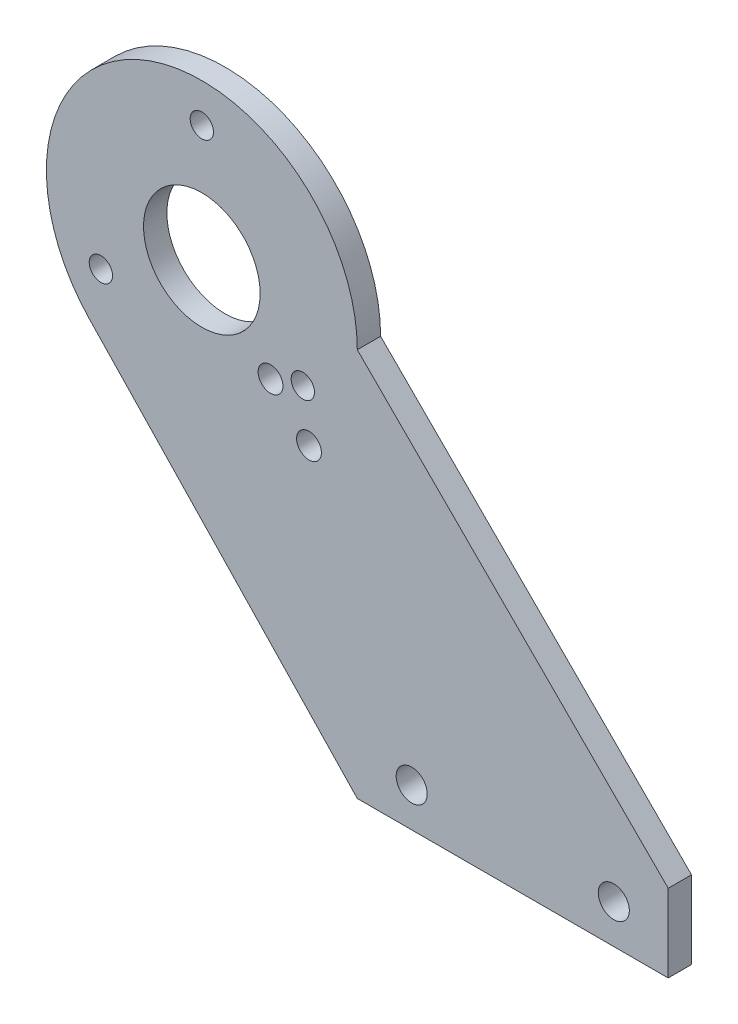
from build123d import *

# Parameters (mm, degrees)
SKETCH1_R               = 7.5
SKETCH1_R_2             = 4
BOSS_EXTRUDE1_DEPTH     = 3
CUT_EXTRUDE1_DEPTH      = 93.175105099
CUT_EXTRUDE1_DEPTH_BACK = 93.175105099
SKETCH2_R               = 1.5
SKETCH2_R_2             = 1.6
CUT_EXTRUDE3_DEPTH      = 93.175105099
CUT_EXTRUDE3_DEPTH_BACK = 93.175105099
SKETCH4_R               = 2
CUT_EXTRUDE4_DEPTH      = 10


with BuildPart() as part:
    # Sketch1 → Boss-Extrude1 (new body)
    with BuildSketch(Plane.XY):
        with BuildLine():
            Line((20, -50), (-14.482758621, -13.793103448))
            ThreePointArc((-14.482758621, -13.793103448), (-19.697630617, 3.464584837), (-8.907060148, 17.907101371))
            Line((-8.907060148, 17.907101371), (60.546469926, 52.453550686))
            ThreePointArc((60.546469926, 52.453550686), (73.60381741, 48.596501346), (70.712169365, 35.292008702))
            Line((70.712169365, 35.292008702), (20, 0))
            Line((20, 0), (60, -40))
            Line((60, -40), (60, -50))
            Line((60, -50), (20, -50))
        make_face()
        Circle(SKETCH1_R, mode=Mode.SUBTRACT)
        with Locations((65, 43.5)):
            Circle(SKETCH1_R_2, mode=Mode.SUBTRACT)
    extrude(amount=BOSS_EXTRUDE1_DEPTH)

    # Sketch2 → Cut-Extrude1 (cut, two sides: drawn at the far end of the back side and taken through both)
    with BuildSketch(Plane.XY.offset(-CUT_EXTRUDE1_DEPTH_BACK)):
        with Locations((0, 15)):
            Circle(SKETCH2_R)
        with Locations((12.990381057, -7.5)):
            Circle(SKETCH2_R)
        with Locations((-12.990381057, -7.5)):
            Circle(SKETCH2_R)
        with Locations((13.788582233, -13.788582233)):
            Circle(SKETCH2_R_2)
        with Locations((8.838834765, -8.838834765)):
            Circle(SKETCH2_R_2)
    extrude(amount=CUT_EXTRUDE1_DEPTH + CUT_EXTRUDE1_DEPTH_BACK, mode=Mode.SUBTRACT)

    # Sketch4 → Cut-Extrude3 (cut, two sides: drawn at the far end of the back side and taken through both)
    with BuildSketch(Plane.XY.offset(-CUT_EXTRUDE3_DEPTH_BACK)):
        with Locations((27, -45)):
            Circle(SKETCH4_R)
        with Locations(Location((53, -45, 0), (0, 0, 180))):
            Circle(SKETCH4_R)
    extrude(amount=CUT_EXTRUDE3_DEPTH + CUT_EXTRUDE3_DEPTH_BACK, mode=Mode.SUBTRACT)

    # Sketch5 → Cut-Extrude4 (cut)
    with BuildSketch(Plane.XY):
        with BuildLine():
            Line((60.546469926, 52.453550686), (-8.907060148, 17.907101371))
            ThreePointArc((-8.907060148, 17.907101371), (10.532302622, 17.002076387), (20, 0))
            Line((20, 0), (70.712169365, 35.292008702))
            ThreePointArc((70.712169365, 35.292008702), (73.60381741, 48.596501346), (60.546469926, 52.453550686))
        make_face()
    extrude(amount=CUT_EXTRUDE4_DEPTH, mode=Mode.SUBTRACT)


solid = part.part
